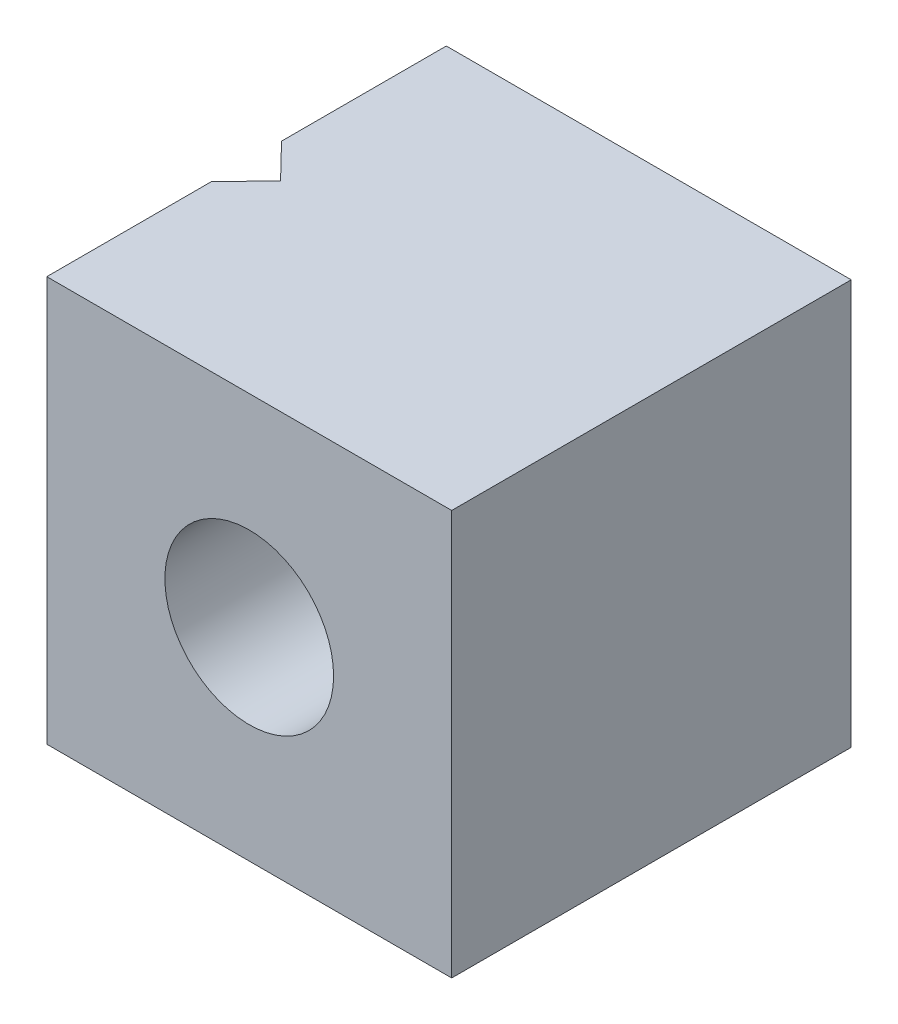
from build123d import *

# Parameters (mm, degrees)
SKETCH1_W               = 19.05
SKETCH1_H               = 19.05
SKETCH1_R               = 3.96875
BOSS_EXTRUDE1_DEPTH     = 18.796
CUT_EXTRUDE1_DEPTH      = 33.849575583
CUT_EXTRUDE1_DEPTH_BACK = 33.849575583


with BuildPart() as part:
    # Sketch1 → Boss-Extrude1 (new body)
    with BuildSketch(Plane.XY):
        with Locations((9.525, -9.525)):
            Rectangle(SKETCH1_W, SKETCH1_H)
        with Locations((9.525, -9.525)):
            Circle(SKETCH1_R, mode=Mode.SUBTRACT)
    extrude(amount=-BOSS_EXTRUDE1_DEPTH)

    # Sketch2 → Cut-Extrude1 (cut, two sides: drawn at the far end of the back side and taken through both)
    with BuildSketch(Plane(origin=(0, 0, 0), x_dir=(1, 0, 0), z_dir=(0, 1, 0)).offset(-CUT_EXTRUDE1_DEPTH_BACK)):
        Polygon((0, 7.751616068), (1.6002, 9.398), (0, 11.044383932), align=None)
    extrude(amount=CUT_EXTRUDE1_DEPTH + CUT_EXTRUDE1_DEPTH_BACK, mode=Mode.SUBTRACT)


solid = part.part
